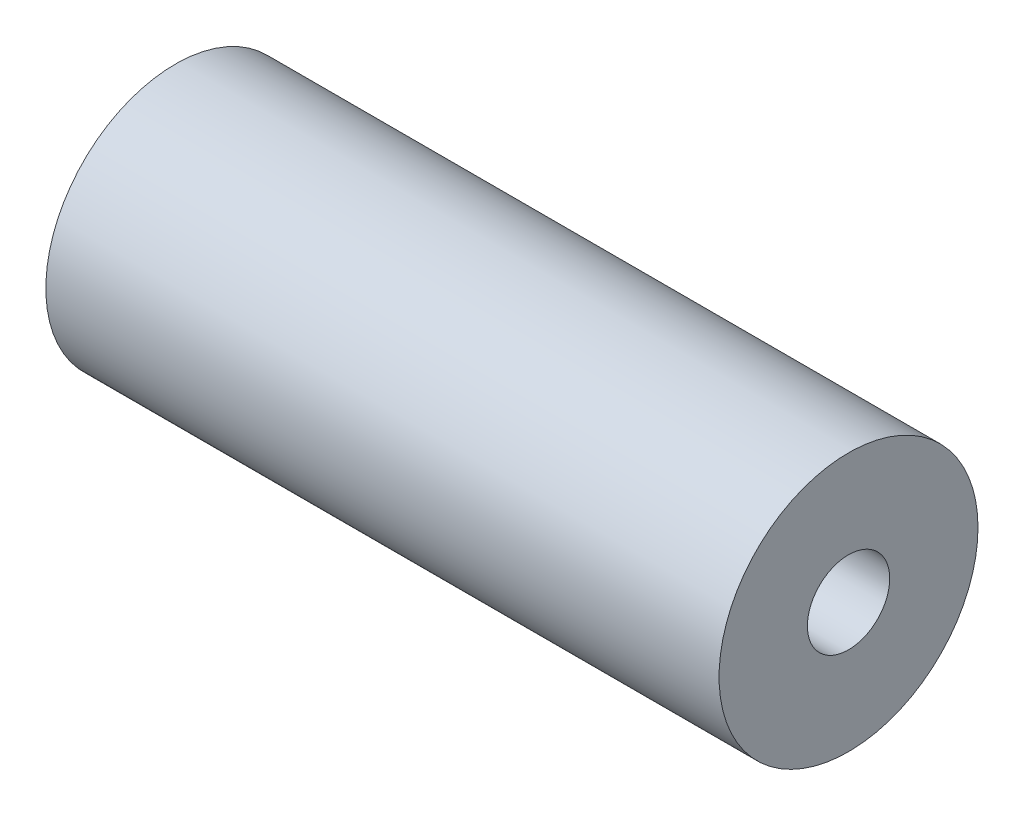
from build123d import *

# Parameters (mm, degrees)
SKETCH1_R           = 6.35
BOSS_EXTRUDE1_DEPTH = 16.51


with BuildPart() as part:
    # Sketch1 → Boss-Extrude1 (new, symmetric)
    with BuildSketch(Plane(origin=(0, 0, 0), x_dir=(0, 0, -1), z_dir=(1, 0, 0))):
        Circle(SKETCH1_R)
    extrude(amount=BOSS_EXTRUDE1_DEPTH, both=True)

    # Sketch3 → Tap Drill for #10-32 Tap1 (revolve, cut)
    with BuildSketch(Plane(origin=(16.51, 0, 0), x_dir=(0, 0, -1), z_dir=(0, 1, 0))):
        Polygon((0, 0), (0, 12.643317848), (2.0193, 11.43), (2.0193, 0), align=None)
    tap_drill_for_10_32_tap1 = revolve(axis=Axis((22.86, 0, 0), (-1, 0, 0)), mode=Mode.SUBTRACT)

    # Mirror1: Tap Drill for #10-32 Tap1 across plane
    add(tap_drill_for_10_32_tap1.mirror(Plane(origin=(0, 0, 0), x_dir=(0, 0, 1), z_dir=(1, 0, 0))), mode=Mode.SUBTRACT)


solid = part.part
